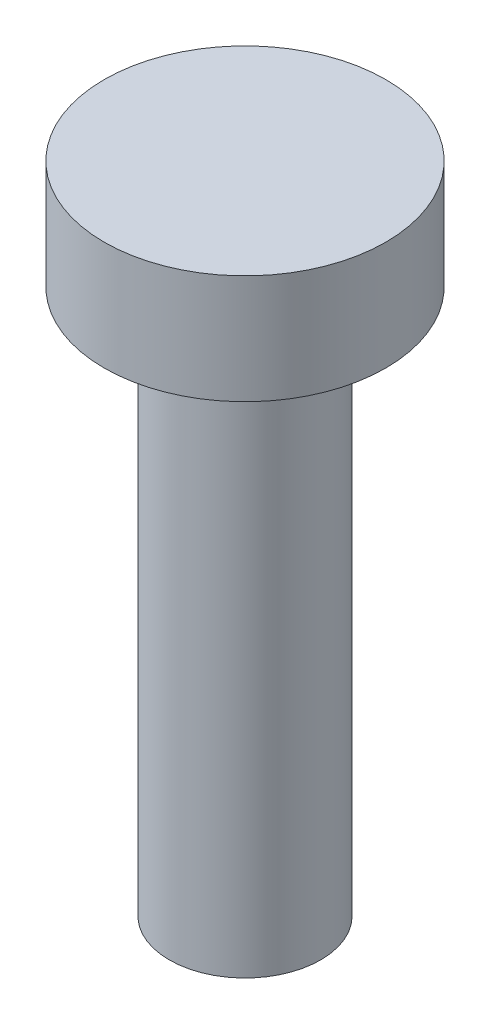
from build123d import *

# Parameters (mm, degrees)
SKETCH_1_R      = 2.5
EXTRUDE_1_DEPTH = 18
SKETCH_2_R      = 4.65
EXTRUDE_2_DEPTH = 3.6


with BuildPart() as part:
    # 草图1 → 凸台-拉伸1 (new body)
    with BuildSketch(Plane(origin=(0, 0, 0), x_dir=(1, 0, 0), z_dir=(0, 1, 0))):
        with Locations(Location((0, 0, 0), (0, 0, 270))):
            Circle(SKETCH_1_R)
    extrude(amount=EXTRUDE_1_DEPTH)

    # 草图2 → 凸台-拉伸2 (add)
    with BuildSketch(Plane(origin=(0, 18, 0), x_dir=(1, 0, 0), z_dir=(0, 1, 0))):
        with Locations(Location((0, 0, 0), (0, 0, 270))):
            Circle(SKETCH_2_R)
    extrude(amount=EXTRUDE_2_DEPTH)


solid = part.part
